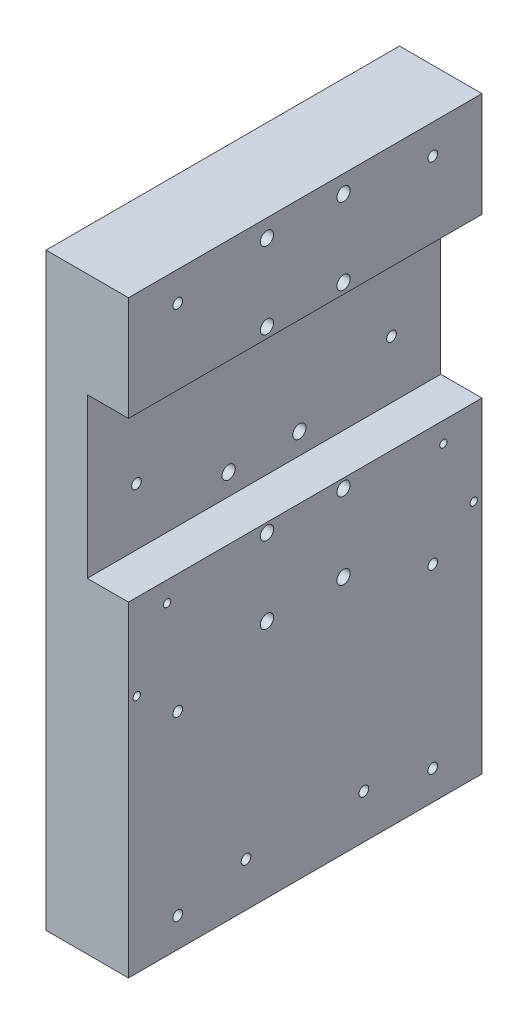
from build123d import *

# Parameters (mm, degrees)
BOSS_EXTRUDE1_DEPTH            = 120
CBORE_FOR_M4_SHCS4_D           = 4.5
CBORE_FOR_M4_SHCS4_CBORE_D     = 8
CBORE_FOR_M4_SHCS4_CBORE_DEPTH = 4
M4_TAPPED_HOLE1_D              = 3.3
M5_TAPPED_HOLE1_D              = 4.2
M5_TAPPED_HOLE1_DEPTH          = 17.4
M5_TAPPED_HOLE1_TIP            = 1.2618073
M4_TAPPED_HOLE2_D              = 3.3
M3_TAPPED_HOLE2_D              = 2.5
M3_TAPPED_HOLE2_DEPTH          = 11.5
M3_TAPPED_HOLE2_TIP            = 0.751075774


with BuildPart() as part:
    # Sketch1 → Boss-Extrude1 (new body)
    with BuildSketch(Plane.XY):
        Polygon((0, 0), (0, 200), (28, 200), (28, 164.5), (14, 164.5), (14, 110.5), (28, 110.5), (28, 0), align=None)
    extrude(amount=BOSS_EXTRUDE1_DEPTH)

    # CBORE for M4 SHCS4 (through all)
    with Locations(Plane(origin=(0, 194, 73), x_dir=(0, 0, -1), z_dir=(-1, 0, 0))):
        with Locations((0, 0), (0, 26), (1, 36.3), (1, 76.3), (0, 86.6), (0, 112.6), (26, 112.6), (26, 86.6), (25, 76.3), (25, 36.3), (26, 26), (26, 0)):
            CounterBoreHole(CBORE_FOR_M4_SHCS4_D / 2, CBORE_FOR_M4_SHCS4_CBORE_D / 2, CBORE_FOR_M4_SHCS4_CBORE_DEPTH)

    # M4 Tapped Hole1 (through all)
    with Locations(Plane(origin=(0, 190, 16.7), x_dir=(0, 0, -1), z_dir=(-1, 0, 0))):
        with Locations((0, 0), (0, 60), (0, 120), (0, 180), (-86.6, 180), (-86.6, 120), (-86.6, 60), (-86.6, 0)):
            Hole(M4_TAPPED_HOLE1_D / 2)

    # M5 Tapped Hole1
    with Locations(Plane(origin=(14, 0, 90), x_dir=(-1, 0, 0), z_dir=(0, -1, 0))):
        with Locations((0, 0), (0, 30), (0, 60)):
            Hole(M5_TAPPED_HOLE1_D / 2, depth=M5_TAPPED_HOLE1_DEPTH)
            with Locations((0, 0, -(M5_TAPPED_HOLE1_DEPTH + M5_TAPPED_HOLE1_TIP / 2))):  # 118° drill point
                Cone(0, M5_TAPPED_HOLE1_D / 2, M5_TAPPED_HOLE1_TIP, mode=Mode.SUBTRACT)

    # M4 Tapped Hole2 (through all)
    with Locations(Plane(origin=(28, 15, 80.1), x_dir=(0, 1, 0), z_dir=(1, 0, 0))):
        with Locations((0, 0), (0, -40)):
            Hole(M4_TAPPED_HOLE2_D / 2)

    # M3 Tapped Hole2
    with Locations(Plane(origin=(28, 103.660435599, 106.9), x_dir=(0, 1, 0), z_dir=(1, 0, 0))):
        with Locations((0, 0), (-22.2, 10.3), (0, -93.8), (-22.2, -104.1)):
            Hole(M3_TAPPED_HOLE2_D / 2, depth=M3_TAPPED_HOLE2_DEPTH)
            with Locations((0, 0, -(M3_TAPPED_HOLE2_DEPTH + M3_TAPPED_HOLE2_TIP / 2))):  # 118° drill point
                Cone(0, M3_TAPPED_HOLE2_D / 2, M3_TAPPED_HOLE2_TIP, mode=Mode.SUBTRACT)


solid = part.part
